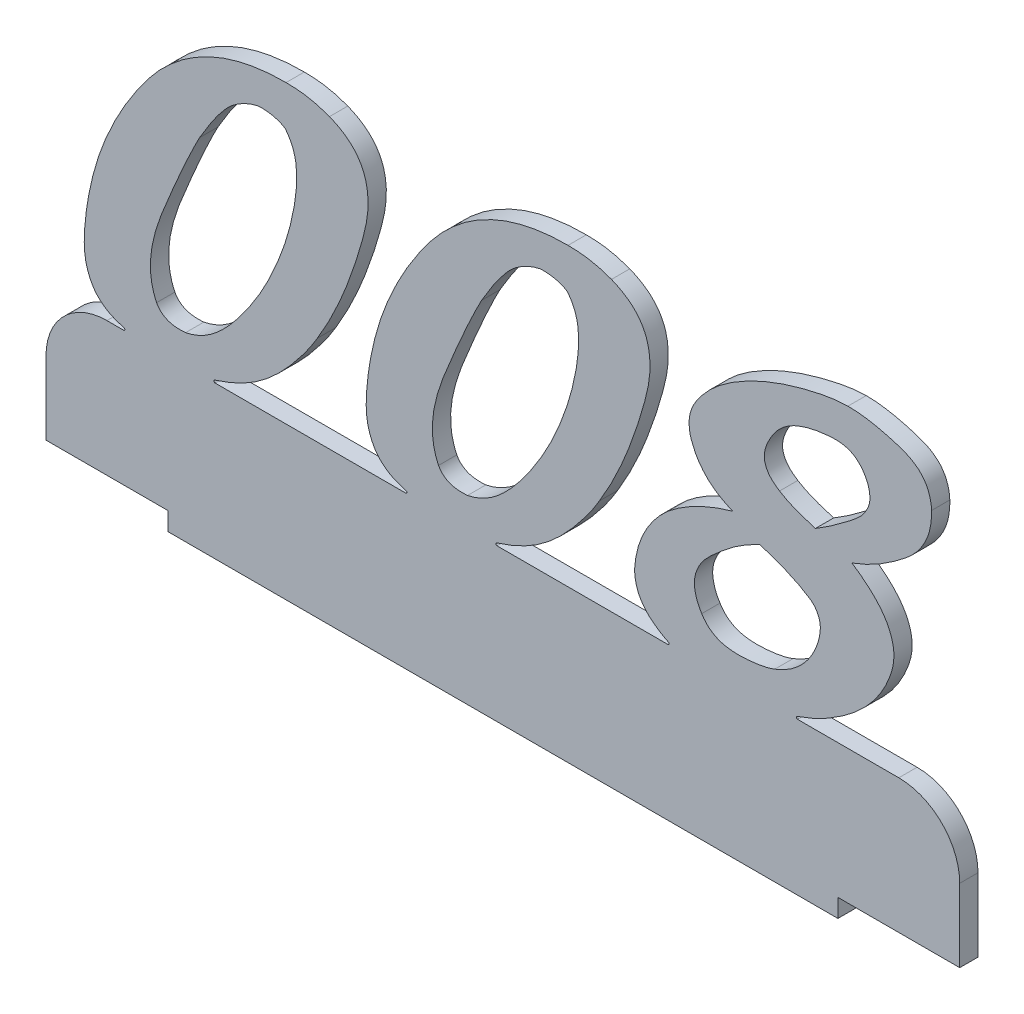
from build123d import *

# Parameters (mm, degrees)
BOSS_EXTRUDE1_DEPTH = 3
FILLET1_R           = 10
FILLET2_R           = 0.2


with BuildPart() as part:
    # Sketch1 → Boss-Extrude1 (new body)
    with BuildSketch(Plane.XY):
        with BuildLine():
            Line((122.108523146, 21.999999999), (150, 21.999999999))
            Line((150, 21.999999999), (150, 0))
            Line((150, 0), (130, 0))
            Line((130, 0), (130, -3))
            Line((130, -3), (20, -3))
            Line((20, -3), (20, 0))
            Line((20, 0), (0, 0))
            Line((0, 0), (0, 21.999999999))
            Line((0, 21.999999999), (14.438541623, 21.999999999))
            add(Edge.make_bspline(
                [(14.438541623, 21.999999999), (13.658105207, 22.162057453), (12.355996148, 22.490581745), (10.600753246, 23.108805441), (9.294367899, 23.958663661), (8.184404903, 24.977724203), (7.354531496, 26.254995051), (6.749049243, 27.726525251), (6.195424836, 30.091367433), (6.265057066, 32.011074008), (6.355399333, 33.325607274)],
                knots=[0.412238486, 0.412238486, 0.412238486, 0.412238486, 0.501387928, 0.562299825, 0.61931963, 0.674487907, 0.729675441, 0.788153341, 0.851799168, 1, 1, 1, 1], degree=3))
            add(Edge.make_bspline(
                [(6.355399333, 33.325607274), (6.522323399, 35.553703682), (7.011516269, 38.879277307), (8.140902742, 43.216081426), (9.203735137, 46.425444807), (10.55835858, 49.558782324), (12.096356804, 52.664611549), (13.904093333, 55.707760491), (15.911178409, 58.674894513), (18.108716846, 61.464243209), (20.582971652, 63.883057011), (23.225236085, 65.970688698), (26.10545634, 67.618079491), (29.140956336, 68.965921182), (33.563364013, 70.188249917), (37.042082868, 70.572964197), (39.40856587, 70.542182723)],
                knots=[0, 0, 0, 0, 0.122246067, 0.183381441, 0.245050885, 0.307031795, 0.37001055, 0.434578783, 0.500534692, 0.565957523, 0.628479512, 0.689453544, 0.749684058, 0.80955899, 0.870724503, 1, 1, 1, 1], degree=3))
            add(Edge.make_bspline(
                [(39.40856587, 70.542182723), (40.668805325, 70.53173287), (43.111644606, 70.388216938), (45.45179853, 69.678361143), (46.543045932, 69.271658877)],
                knots=[0, 0, 0, 0, 0.519885394, 1, 1, 1, 1], degree=3))
            add(Edge.make_bspline(
                [(46.543045932, 69.271658877), (47.810593346, 68.756360664), (49.605646004, 67.763010693), (51.34495867, 65.780098674), (52.254480763, 64.106624553), (52.769763344, 62.201705739), (52.935074319, 60.084660377), (52.741966882, 57.753891833), (51.992566616, 54.41448429), (50.71404627, 50.248056205), (48.412862659, 43.944476691), (46.215946476, 39.5181993), (44.549300819, 36.76579492)],
                knots=[0, 0, 0, 0, 0.111905612, 0.162582178, 0.212592743, 0.265416324, 0.321765959, 0.384451445, 0.45478123, 0.599580751, 0.738515281, 1, 1, 1, 1], degree=3))
            add(Edge.make_bspline(
                [(44.549300819, 36.76579492), (43.4578167, 34.908582637), (41.587519267, 32.338108151), (38.838167888, 29.215125041), (36.669472991, 27.145857207), (34.287041313, 25.338194752), (31.607317517, 23.842400639), (28.926282762, 22.752537275), (27.1241466, 22.208599971), (26.335552869, 21.999999999)],
                knots=[0, 0, 0, 0, 0.257859597, 0.380113614, 0.498337489, 0.61657684, 0.737567111, 0.865047578, 0.962803207, 0.962803207, 0.962803207, 0.962803207], degree=3))
            Line((26.335552869, 21.999999999), (60.72470269, 21.999999999))
            add(Edge.make_bspline(
                [(60.72470269, 21.999999999), (59.944266273, 22.162057454), (58.642157213, 22.490581744), (56.886914309, 23.108805441), (55.580528962, 23.958663661), (54.470565966, 24.977724203), (53.640692559, 26.254995051), (53.035210306, 27.726525251), (52.481585899, 30.091367433), (52.55121813, 32.011074008), (52.641560397, 33.325607274)],
                knots=[0.412238486, 0.412238486, 0.412238486, 0.412238486, 0.501387928, 0.562299825, 0.61931963, 0.674487907, 0.729675441, 0.788153341, 0.851799168, 1, 1, 1, 1], degree=3))
            add(Edge.make_bspline(
                [(52.641560397, 33.325607274), (52.808484463, 35.553703682), (53.297677333, 38.879277307), (54.427063806, 43.216081426), (55.4898962, 46.425444807), (56.844519643, 49.558782324), (58.382517868, 52.664611549), (60.190254397, 55.707760491), (62.197339473, 58.674894513), (64.394877909, 61.464243209), (66.869132715, 63.883057011), (69.511397149, 65.970688698), (72.391617403, 67.618079491), (75.427117399, 68.965921182), (79.849525076, 70.188249917), (83.328243932, 70.572964197), (85.694726933, 70.542182723)],
                knots=[0, 0, 0, 0, 0.122246067, 0.183381441, 0.245050885, 0.307031795, 0.37001055, 0.434578783, 0.500534692, 0.565957523, 0.628479512, 0.689453544, 0.749684058, 0.80955899, 0.870724503, 1, 1, 1, 1], degree=3))
            add(Edge.make_bspline(
                [(85.694726933, 70.542182723), (86.954966388, 70.53173287), (89.39780567, 70.388216938), (91.737959593, 69.678361143), (92.829206995, 69.271658877)],
                knots=[0, 0, 0, 0, 0.519885394, 1, 1, 1, 1], degree=3))
            add(Edge.make_bspline(
                [(92.829206995, 69.271658877), (94.096754409, 68.756360664), (95.891807067, 67.763010693), (97.631119733, 65.780098674), (98.540641826, 64.106624553), (99.055924408, 62.201705739), (99.221235382, 60.084660377), (99.028127945, 57.753891833), (98.278727679, 54.41448429), (97.000207333, 50.248056205), (94.699023722, 43.944476691), (92.50210754, 39.5181993), (90.835461882, 36.76579492)],
                knots=[0, 0, 0, 0, 0.111905612, 0.162582178, 0.212592743, 0.265416324, 0.321765959, 0.384451445, 0.45478123, 0.599580751, 0.738515281, 1, 1, 1, 1], degree=3))
            add(Edge.make_bspline(
                [(90.835461882, 36.76579492), (89.743977764, 34.908582637), (87.873680331, 32.338108151), (85.124328951, 29.215125041), (82.955634054, 27.145857207), (80.573202377, 25.338194752), (77.89347858, 23.842400639), (75.212443825, 22.752537274), (73.410307661, 22.208599971), (72.621713928, 21.999999999)],
                knots=[0, 0, 0, 0, 0.257859597, 0.380113614, 0.498337489, 0.61657684, 0.737567111, 0.865047578, 0.962803208, 0.962803208, 0.962803208, 0.962803208], degree=3))
            Line((72.621713928, 21.999999999), (103.04516948, 21.999999999))
            add(Edge.make_bspline(
                [(103.04516948, 21.999999999), (102.930967047, 22.052009164), (102.817479083, 22.105904381)],
                knots=[0.990597289, 0.990597289, 0.990597289, 1, 1, 1], degree=2))
            add(Edge.make_bspline(
                [(102.817479083, 22.105904381), (101.757228234, 22.524010321), (100.350687809, 23.354272094), (98.737450415, 24.692365052), (97.854538041, 25.780125934), (97.181601504, 26.958075411), (96.779894695, 28.237110779), (96.589789083, 29.607498863), (96.734370359, 31.513764346), (97.246545453, 33.880493857), (98.813703117, 37.479421898), (100.70906752, 39.780671789), (102.231083461, 41.046482958)],
                knots=[0, 0, 0, 0, 0.145411865, 0.208169502, 0.267501374, 0.323943122, 0.380974613, 0.438243953, 0.500117871, 0.624909066, 0.74681812, 1, 1, 1, 1], degree=3))
            add(Edge.make_bspline(
                [(102.231083461, 41.046482958), (103.671406303, 42.240838159), (107.039865136, 44.312846127), (110.734158171, 45.715498297), (112.727565088, 46.26540399)],
                knots=[0, 0, 0, 0, 0.47455103, 1, 1, 1, 1], degree=3))
            add(Edge.make_bspline(
                [(112.727565088, 46.26540399), (111.569321603, 46.760434406), (109.423666534, 47.856042081), (107.789017108, 49.626169721), (107.176353203, 50.546092027)],
                knots=[0, 0, 0, 0, 0.533806503, 1, 1, 1, 1], degree=3))
            add(Edge.make_bspline(
                [(107.176353203, 50.546092027), (106.704577468, 51.217263717), (106.202946494, 52.282653885), (105.693104534, 53.728683336), (105.579017848, 54.770939754), (105.558169073, 55.785745365), (105.747699291, 56.775270602), (106.082117261, 57.744045705), (106.754352851, 59.003608473), (107.868366261, 60.484008105), (109.435647561, 62.165382302), (111.309301994, 63.682396409), (113.426169076, 65.056092592), (115.709811084, 66.309591214), (118.123784404, 67.433097701), (120.645628146, 68.37771692), (123.196557566, 69.189037209), (125.662540001, 69.808937837), (128.451115192, 70.412429132), (130.428235333, 70.641826844), (131.648597144, 70.659461848)],
                knots=[0, 0, 0, 0, 0.06549304, 0.094653669, 0.122662004, 0.149381383, 0.175997836, 0.203170507, 0.231524607, 0.290419573, 0.351573513, 0.415971759, 0.483685908, 0.554266051, 0.625290081, 0.69758578, 0.770657525, 0.84041818, 0.901965828, 1, 1, 1, 1], degree=3))
            add(Edge.make_bspline(
                [(131.648597144, 70.659461848), (133.021148761, 70.666775686), (135.147477863, 70.418006456), (138.02565522, 69.744340185), (139.941076661, 69.195827032), (141.447185356, 68.623895471), (142.45361538, 68.072388404), (143.324821444, 67.429751295), (144.042067177, 66.677244189), (144.602095312, 65.814440534), (145.152974117, 64.500760832), (145.356470016, 63.423652941), (145.370254689, 62.684481394)],
                knots=[0, 0, 0, 0, 0.233892394, 0.363935643, 0.504338219, 0.573730952, 0.638437931, 0.699607367, 0.757823999, 0.814892599, 0.874182923, 1, 1, 1, 1], degree=3))
            add(Edge.make_bspline(
                [(145.370254689, 62.684481394), (145.391282821, 61.826461305), (145.288660402, 60.553966429), (144.871612861, 58.923892535), (144.394325927, 57.784529313), (143.778059042, 56.700100414), (143.040944158, 55.662671002), (142.141413179, 54.691951733), (140.77663239, 53.504445047), (138.970861394, 52.173462664), (136.116110274, 50.306557233), (133.839504864, 49.253250191), (132.313178849, 48.689172559)],
                knots=[0, 0, 0, 0, 0.1258437, 0.186121428, 0.246118105, 0.306463999, 0.368798255, 0.432387663, 0.500096353, 0.633912068, 0.76117706, 1, 1, 1, 1], degree=3))
            add(Edge.make_bspline(
                [(132.313178849, 48.689172559), (133.616687642, 47.827803014), (135.400976063, 46.451189574), (137.29884975, 44.320153371), (138.290268754, 42.742184732), (138.92514462, 41.123702756), (139.235589207, 39.470058726), (139.169728819, 37.77657171), (138.738965525, 36.094265261), (138.062989812, 34.441220615), (137.219806002, 32.829664138), (136.199931185, 31.28349199), (135.001831945, 29.803250593), (133.598092038, 28.42727527), (131.489949413, 26.58883737), (129.670514845, 25.441109099), (128.423421225, 24.686045116)],
                knots=[0, 0, 0, 0, 0.151286601, 0.216505732, 0.275096334, 0.330573675, 0.383732792, 0.436708517, 0.493116048, 0.550815109, 0.609171341, 0.668780227, 0.729710583, 0.79299462, 0.85869013, 1, 1, 1, 1], degree=3))
            add(Edge.make_bspline(
                [(128.423421225, 24.686045116), (126.614506705, 23.639732778), (124.492654818, 22.74468498), (122.304948454, 22.059710031), (122.108523146, 21.999999999)],
                knots=[0, 0, 0, 0, 0.23548636, 0.258651708, 0.258651708, 0.258651708, 0.258651708], degree=3))
        make_face()
        with BuildLine():
            add(Edge.make_bspline(
                [(39.271740225, 63.93545872), (38.670480258, 64.34497587), (37.205191952, 64.851120066), (35.667395912, 64.978415201), (34.854226542, 64.932331277)],
                knots=[0, 0, 0, 0, 0.469698931, 1, 1, 1, 1], degree=3))
            add(Edge.make_bspline(
                [(34.854226542, 64.932331277), (33.70952527, 64.691642775), (32.091486362, 64.014114469), (30.203099418, 62.636548721), (27.895192741, 60.058488446), (26.361494977, 57.606904398), (25.217791827, 55.628187414)],
                knots=[0, 0, 0, 0, 0.252589616, 0.375811021, 0.503770371, 1, 1, 1, 1], degree=3))
            add(Edge.make_bspline(
                [(25.217791827, 55.628187414), (24.761513012, 54.83013166), (24.163293198, 53.513566034), (23.271780036, 51.694503675), (22.558312375, 50.112955726), (21.793930851, 48.393727242), (20.993443548, 46.526998398), (20.136844749, 44.530790296), (19.264780731, 42.442468588), (18.471792239, 40.344292593), (17.840136532, 38.316939407), (17.399330992, 36.409845703), (17.156429507, 34.616801859), (17.109115678, 32.937517329), (17.31081985, 30.911818123), (17.730327856, 29.488160771), (18.161497848, 28.634442301)],
                knots=[0, 0, 0, 0, 0.095871325, 0.150956838, 0.211549603, 0.277044413, 0.347448488, 0.423659813, 0.503898773, 0.583776288, 0.6578152, 0.725493304, 0.78794858, 0.846481479, 0.900510454, 1, 1, 1, 1], degree=3))
            add(Edge.make_bspline(
                [(18.161497848, 28.634442301), (18.519944689, 27.891425283), (20.019418745, 26.684149801), (21.932319792, 26.66756155), (22.911302383, 26.738429791)],
                knots=[0, 0, 0, 0, 0.446153942, 1, 1, 1, 1], degree=3))
            add(Edge.make_bspline(
                [(22.911302383, 26.738429791), (24.368826881, 27.012785), (26.525422149, 28.031205565), (29.057723666, 30.198975097), (31.008185616, 32.356167675), (32.874984655, 34.841686847), (34.636510421, 37.515688643), (36.226958558, 40.342175241), (37.621486477, 43.298423242), (38.819636645, 46.315407701), (39.811171625, 49.32746955), (40.529853514, 52.315966404), (41.034390722, 55.206569752), (41.204007542, 57.908325008), (41.002141408, 60.938888173), (40.127294796, 62.927439637), (39.271740225, 63.93545872)],
                knots=[0, 0, 0, 0, 0.099522769, 0.157975555, 0.224341199, 0.295661745, 0.367825167, 0.440561069, 0.514605516, 0.588508481, 0.659789613, 0.728660389, 0.796041852, 0.857776262, 0.9112652, 1, 1, 1, 1], degree=3))
        make_face(mode=Mode.SUBTRACT)
        with BuildLine():
            add(Edge.make_bspline(
                [(85.557901288, 63.93545872), (84.956641322, 64.34497587), (83.491353016, 64.851120066), (81.953556976, 64.978415201), (81.140387605, 64.932331277)],
                knots=[0, 0, 0, 0, 0.469698931, 1, 1, 1, 1], degree=3))
            add(Edge.make_bspline(
                [(81.140387605, 64.932331277), (79.995686333, 64.691642775), (78.377647426, 64.014114469), (76.489260482, 62.636548721), (74.181353804, 60.058488446), (72.64765604, 57.606904398), (71.503952891, 55.628187414)],
                knots=[0, 0, 0, 0, 0.252589616, 0.375811021, 0.503770371, 1, 1, 1, 1], degree=3))
            add(Edge.make_bspline(
                [(71.503952891, 55.628187414), (71.047674075, 54.83013166), (70.449454261, 53.513566034), (69.5579411, 51.694503675), (68.844473438, 50.112955726), (68.080091914, 48.393727242), (67.279604611, 46.526998398), (66.423005812, 44.530790296), (65.550941795, 42.442468588), (64.757953303, 40.344292593), (64.126297595, 38.316939407), (63.685492055, 36.409845703), (63.44259057, 34.616801859), (63.395276742, 32.937517329), (63.596980913, 30.911818123), (64.016488919, 29.488160771), (64.447658911, 28.634442301)],
                knots=[0, 0, 0, 0, 0.095871325, 0.150956838, 0.211549603, 0.277044413, 0.347448488, 0.423659813, 0.503898773, 0.583776288, 0.6578152, 0.725493304, 0.78794858, 0.846481479, 0.900510454, 1, 1, 1, 1], degree=3))
            add(Edge.make_bspline(
                [(64.447658911, 28.634442301), (64.806105752, 27.891425283), (66.305579808, 26.684149801), (68.218480855, 26.66756155), (69.197463446, 26.738429791)],
                knots=[0, 0, 0, 0, 0.446153942, 1, 1, 1, 1], degree=3))
            add(Edge.make_bspline(
                [(69.197463446, 26.738429791), (70.654987944, 27.012785), (72.811583212, 28.031205565), (75.343884729, 30.198975097), (77.294346679, 32.356167675), (79.161145718, 34.841686847), (80.922671484, 37.515688643), (82.513119622, 40.342175241), (83.907647541, 43.298423242), (85.105797709, 46.315407701), (86.097332688, 49.32746955), (86.816014577, 52.315966404), (87.320551786, 55.206569752), (87.490168605, 57.908325008), (87.288302471, 60.938888173), (86.413455859, 62.927439637), (85.557901288, 63.93545872)],
                knots=[0, 0, 0, 0, 0.099522769, 0.157975555, 0.224341199, 0.295661745, 0.367825167, 0.440561069, 0.514605516, 0.588508481, 0.659789613, 0.728660389, 0.796041852, 0.857776262, 0.9112652, 1, 1, 1, 1], degree=3))
        make_face(mode=Mode.SUBTRACT)
        with BuildLine():
            add(Edge.make_bspline(
                [(126.37103655, 33.657898126), (126.703070865, 34.377896028), (127.006962915, 35.466430318), (127.149905115, 36.897007515), (127.035977222, 37.82595134), (126.725924053, 38.662344183), (126.254485521, 39.421809758), (125.571926096, 40.068132712), (122.714489742, 41.866606408), (119.798338355, 42.929237669), (117.203718332, 43.743902817)],
                knots=[0, 0, 0, 0, 0.146791532, 0.208761461, 0.266158213, 0.319044196, 0.373488798, 0.430885549, 0.492033069, 1, 1, 1, 1], degree=3))
            add(Edge.make_bspline(
                [(117.203718332, 43.743902817), (115.832888415, 43.137848687), (113.755161239, 41.957009641), (111.129043232, 39.900096753), (109.381226087, 38.39039084), (108.076456784, 37.058188004), (107.31690061, 35.983616712), (106.780065532, 34.889318004), (106.47287337, 33.768169921), (106.41228761, 32.628111064), (106.679731597, 31.031584741), (107.177235564, 29.880238487), (107.645469701, 29.162198361)],
                knots=[0, 0, 0, 0, 0.226026675, 0.358514738, 0.502651098, 0.574260459, 0.639154779, 0.700254354, 0.757231106, 0.813328021, 0.871012378, 1, 1, 1, 1], degree=3))
            add(Edge.make_bspline(
                [(107.645469701, 29.162198361), (108.172381566, 28.278430119), (109.364183343, 27.149002215), (111.446286518, 26.47190533), (113.191788999, 26.284818338), (114.973535726, 26.344749184), (117.154331243, 26.562498316), (118.702990106, 26.90368271), (119.647033422, 27.266185851)],
                knots=[0, 0, 0, 0, 0.236244355, 0.359750019, 0.496904189, 0.637587899, 0.768460398, 1, 1, 1, 1], degree=3))
            add(Edge.make_bspline(
                [(119.647033422, 27.266185851), (121.151474033, 27.831571964), (123.941149587, 29.509362949), (125.785443652, 32.196744209), (126.37103655, 33.657898126)],
                knots=[0, 0, 0, 0, 0.505931264, 1, 1, 1, 1], degree=3))
        make_face(mode=Mode.SUBTRACT)
        with BuildLine():
            add(Edge.make_bspline(
                [(134.619668293, 61.883074045), (134.144099585, 62.853460082), (133.016580214, 64.178751613), (130.854801899, 64.89040922), (129.088628055, 64.932942083), (127.320873954, 64.740135561), (125.182154087, 64.390504372), (123.70990081, 63.875984791), (122.813569779, 63.466342223)],
                knots=[0, 0, 0, 0, 0.248439188, 0.370849343, 0.507488924, 0.647530709, 0.775535549, 1, 1, 1, 1], degree=3))
            add(Edge.make_bspline(
                [(122.813569779, 63.466342223), (121.841823691, 63.005099154), (120.473219832, 62.029728024), (119.140075913, 60.209143785), (118.450775148, 58.913059201), (118.045634267, 57.809977258), (117.904525694, 56.996294501), (117.911688194, 56.213888295), (118.124005844, 55.479867786), (118.459262261, 54.779521371), (119.164329468, 53.859208), (119.908003146, 53.331383647), (120.428894251, 52.989407117)],
                knots=[0, 0, 0, 0, 0.241285471, 0.367347555, 0.502441532, 0.568888314, 0.629574889, 0.686496463, 0.742418177, 0.799189957, 0.859595249, 1, 1, 1, 1], degree=3))
            add(Edge.make_bspline(
                [(120.428894251, 52.989407117), (121.212422518, 52.475500782), (123.149262135, 51.59204863), (125.163323584, 50.915145083), (126.312396988, 50.60473159)],
                knots=[0, 0, 0, 0, 0.439760853, 1, 1, 1, 1], degree=3))
            add(Edge.make_bspline(
                [(126.312396988, 50.60473159), (127.278739663, 51.165738391), (128.789055479, 52.153438789), (130.865217713, 53.690472583), (132.357513474, 54.799479925), (133.514596116, 55.800177121), (134.23401489, 56.59892399), (134.747094445, 57.439589287), (135.117975851, 58.283155815), (135.281437853, 59.166855579), (135.203528445, 60.402239611), (134.941506371, 61.316304149), (134.619668293, 61.883074045)],
                knots=[0, 0, 0, 0, 0.215363212, 0.34750938, 0.497992174, 0.573615258, 0.642146688, 0.704190046, 0.762740496, 0.818911913, 0.875489106, 1, 1, 1, 1], degree=3))
        make_face(mode=Mode.SUBTRACT)
    extrude(amount=BOSS_EXTRUDE1_DEPTH)

    # Fillet1
    fillet1_edges = [part.edges().sort_by_distance(p)[0] for p in [
        (0, 21.999999999, 1.5),
        (150, 21.999999999, 1.5),
    ]]
    fillet(fillet1_edges, radius=FILLET1_R)

    # Fillet2
    fillet2_edges = [part.edges().sort_by_distance(p)[0] for p in [
        (26.335552869, 21.999999999, 1.5),
        (72.621713928, 21.999999999, 1.5),
        (122.108523146, 21.999999999, 1.5),
        (103.04516948, 21.999999999, 1.5),
        (60.72470269, 21.999999999, 1.5),
        (14.438541623, 21.999999999, 1.5),
    ]]
    fillet(fillet2_edges, radius=FILLET2_R)


solid = part.part
